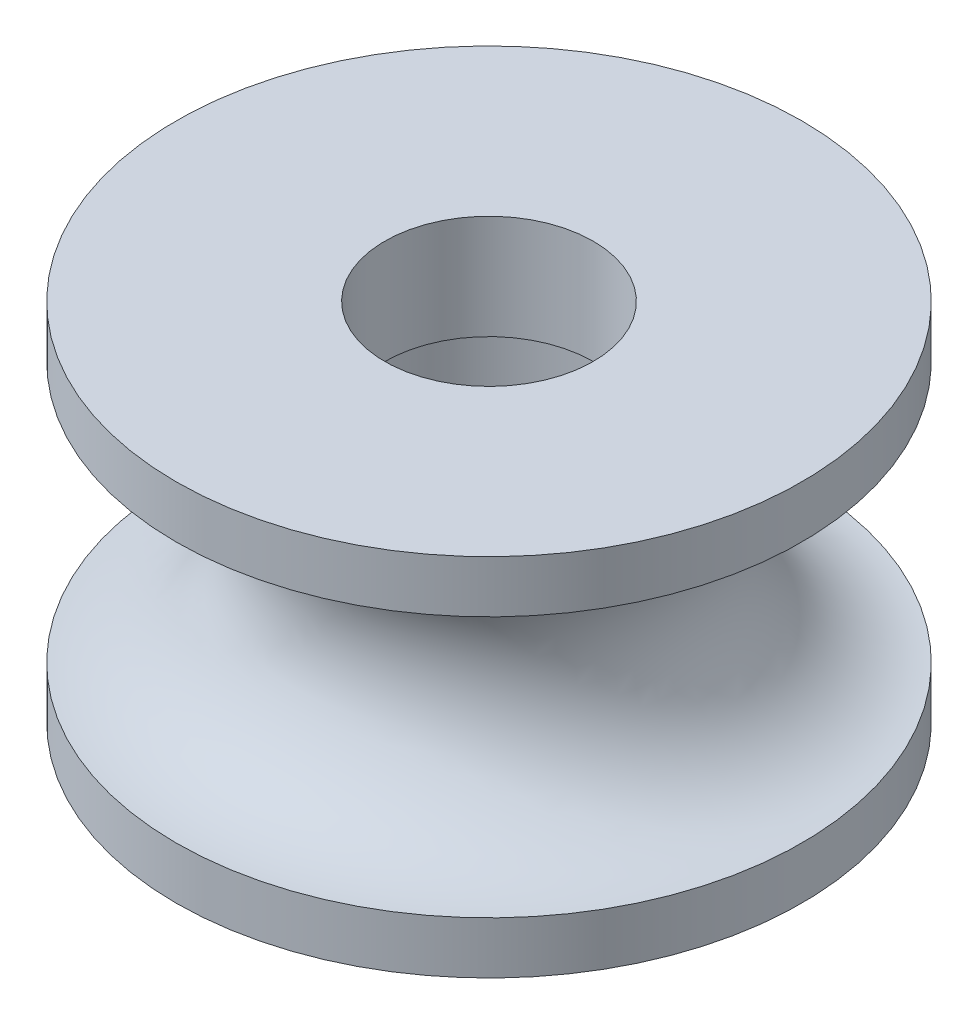
from build123d import *

# Parameters (mm, degrees)
SKETCH_9_W          = 1
SKETCH_9_H          = 4
SKETCH_10_R         = 5.1
CUT_EXTRUDE_1_DEPTH = 10


with BuildPart() as part:
    # 草图7 → 旋转1 (revolve)
    with BuildSketch(Plane.XY, mode=Mode.PRIVATE) as revolve_1_sk:
        with BuildLine():
            Line((-5, 4), (-5, -4))
            Line((-5, -4), (-5, -7))
            Line((-5, -7), (-12, -7))
            Line((-12, -7), (-12, -5))
            ThreePointArc((-12, -5), (-7, 0), (-12, 5))
            Line((-12, 5), (-12, 7))
            Line((-12, 7), (-5, 7))
            Line((-5, 7), (-5, 4))
        make_face()
    revolve(revolve_1_sk.sketch.rotate(Axis((0, 0, 0), (0, 1, 0)), 270), axis=Axis((0, 0, 0), (0, 1, 0)))

    # 草图9 → 旋转2 (revolve)
    with BuildSketch(Plane.XY, mode=Mode.PRIVATE) as revolve_2_sk:
        with Locations((-4.5, 5)):
            Rectangle(SKETCH_9_W, SKETCH_9_H)
        with Locations((-4.5, -5)):
            Rectangle(SKETCH_9_W, SKETCH_9_H)
    revolve(revolve_2_sk.sketch.rotate(Axis((0, 0, 0), (0, 1, 0)), 270), axis=Axis((0, 0, 0), (0, 1, 0)))

    # 草图10 → 切除-拉伸1 (cut)
    with BuildSketch(Plane.XZ.offset(7)):
        with Locations(Location((0, 0, 0), (0, 0, 270))):
            Circle(SKETCH_10_R)
    extrude(amount=-CUT_EXTRUDE_1_DEPTH, mode=Mode.SUBTRACT)


solid = part.part
